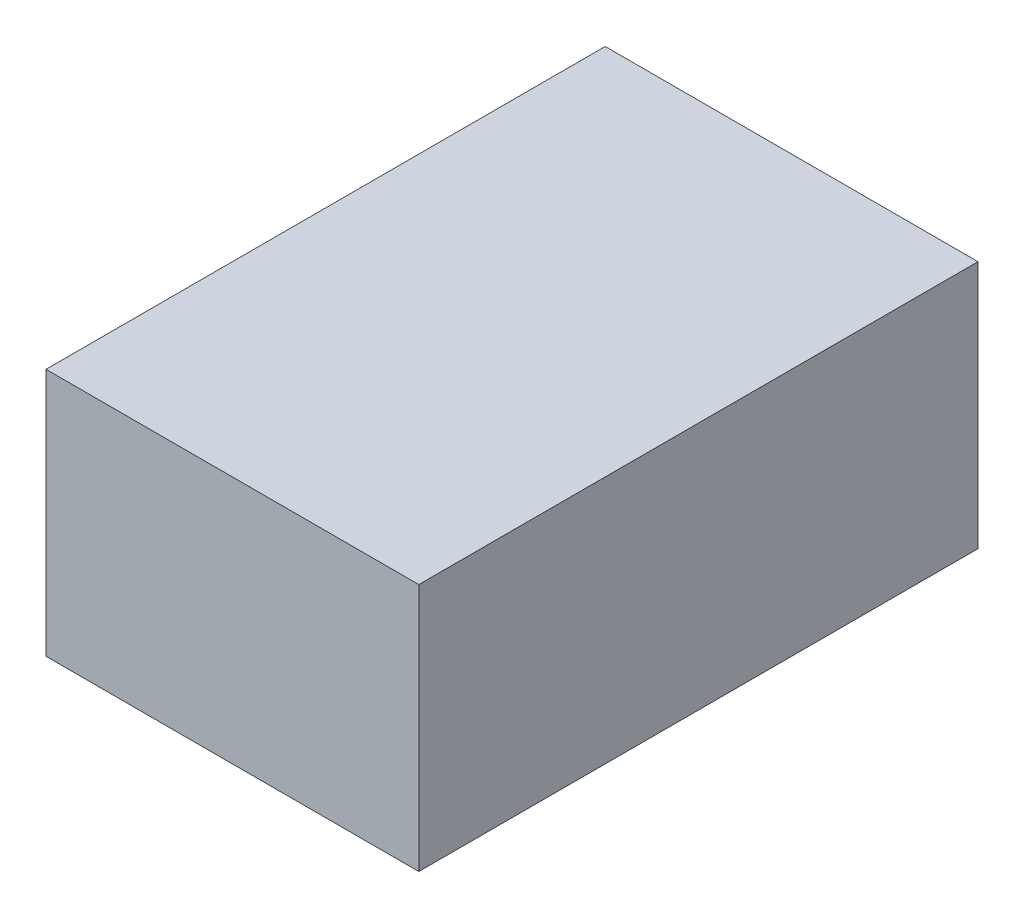
from build123d import *

# Parameters (mm, degrees)
SKETCH1_W           = 30
SKETCH1_H           = 45
BOSS_EXTRUDE1_DEPTH = 10


with BuildPart() as part:
    # Sketch1 → Boss-Extrude1 (new, symmetric)
    with BuildSketch(Plane(origin=(0, 0, 0), x_dir=(1, 0, 0), z_dir=(0, 1, 0))):
        Rectangle(SKETCH1_W, SKETCH1_H)
    extrude(amount=BOSS_EXTRUDE1_DEPTH, both=True)


solid = part.part
